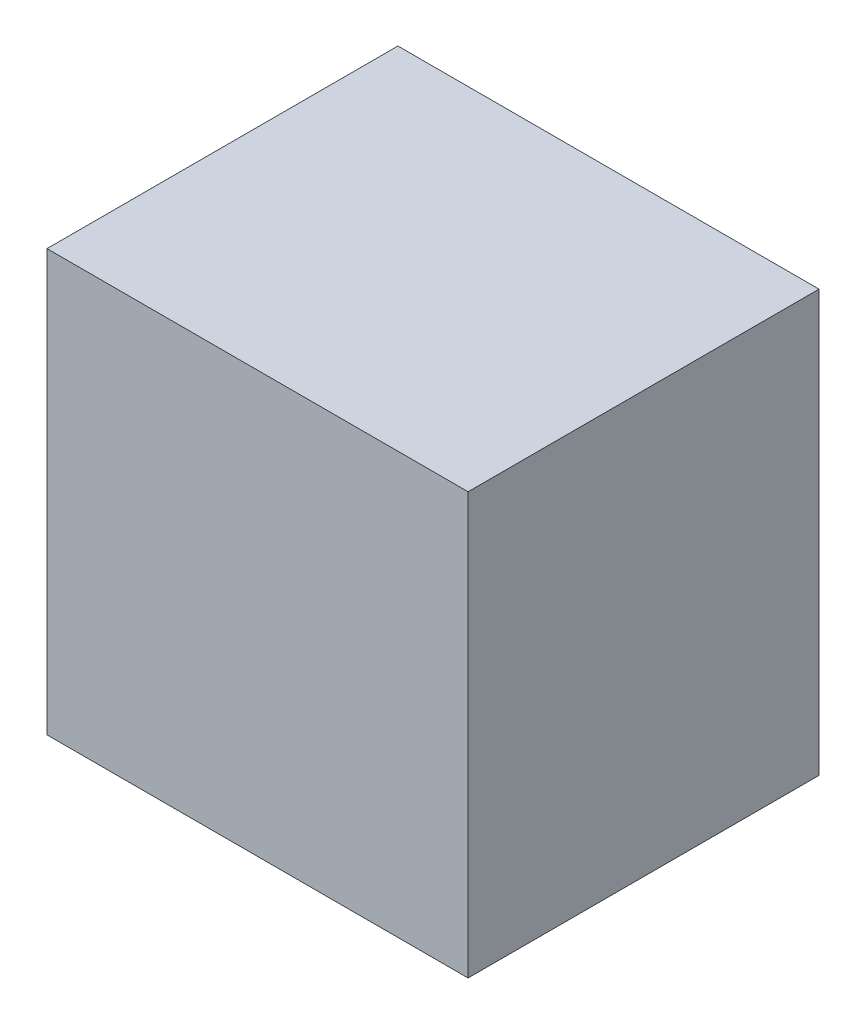
from build123d import *

# Parameters (mm, degrees)
BODY_SKETCH_W = 36
BODY_SKETCH_H = 36
BODY_DEPTH    = 30


with BuildPart() as part:
    # Body sketch → Body (new body)
    with BuildSketch(Plane.XY):
        with Locations((18, 18)):
            Rectangle(BODY_SKETCH_W, BODY_SKETCH_H)
    extrude(amount=BODY_DEPTH)


solid = part.part
